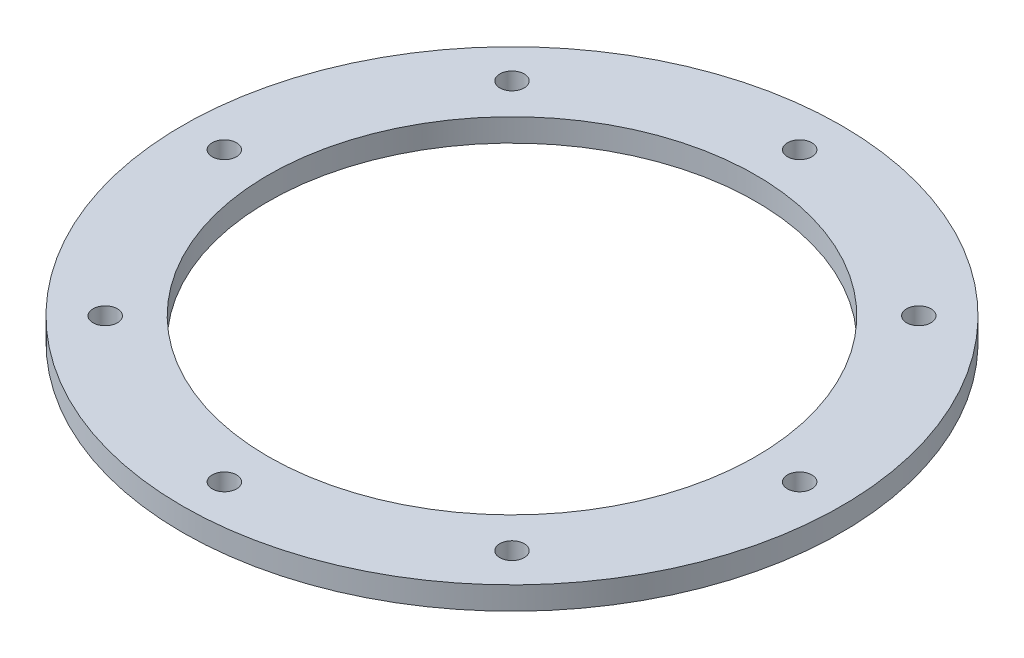
from build123d import *

# Parameters (mm, degrees)
SKETCH1_R           = 43.25
SKETCH1_R_2         = 32
SKETCH1_R_3         = 1.6
BOSS_EXTRUDE1_DEPTH = 3


with BuildPart() as part:
    # Sketch1 → Boss-Extrude1 (new body)
    with BuildSketch(Plane(origin=(0, 0, 0), x_dir=(1, 0, 0), z_dir=(0, 1, 0))):
        with Locations(Location((0, 0, 0), (0, 0, 270))):
            Circle(SKETCH1_R)
        with Locations(Location((0, 0, 0), (0, 0, 270))):
            Circle(SKETCH1_R_2, mode=Mode.SUBTRACT)
        with Locations(Location((0, 37.75, 0), (0, 0, 270))):
            Circle(SKETCH1_R_3, mode=Mode.SUBTRACT)
        with Locations(Location((26.69328099, 26.69328099, 0), (0, 0, 270))):
            Circle(SKETCH1_R_3, mode=Mode.SUBTRACT)
        with Locations(Location((37.75, 0, 0), (0, 0, 270))):
            Circle(SKETCH1_R_3, mode=Mode.SUBTRACT)
        with Locations(Location((26.69328099, -26.69328099, 0), (0, 0, 270))):
            Circle(SKETCH1_R_3, mode=Mode.SUBTRACT)
        with Locations(Location((0, -37.75, 0), (0, 0, 270))):
            Circle(SKETCH1_R_3, mode=Mode.SUBTRACT)
        with Locations(Location((-26.69328099, -26.69328099, 0), (0, 0, 270))):
            Circle(SKETCH1_R_3, mode=Mode.SUBTRACT)
        with Locations(Location((-37.75, 0, 0), (0, 0, 270))):
            Circle(SKETCH1_R_3, mode=Mode.SUBTRACT)
        with Locations(Location((-26.69328099, 26.69328099, 0), (0, 0, 270))):
            Circle(SKETCH1_R_3, mode=Mode.SUBTRACT)
    extrude(amount=BOSS_EXTRUDE1_DEPTH)


solid = part.part
